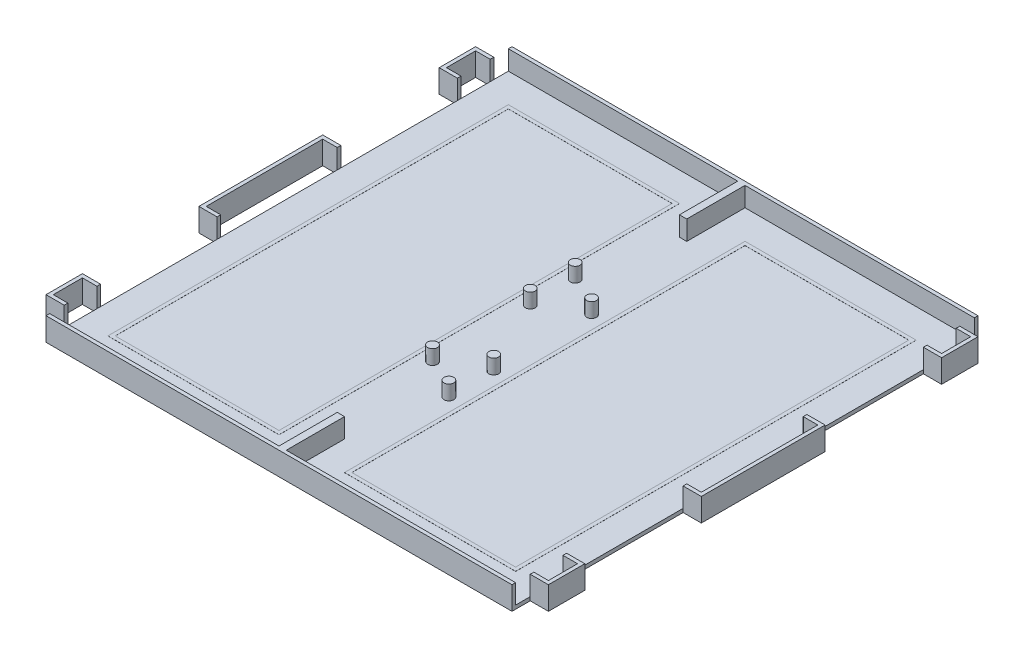
from build123d import *

# Parameters (mm, degrees)
SKETCH1_W                  = 2438.4
SKETCH1_H                  = 2438.4
BOSS_EXTRUDE1_DEPTH        = 19.05
BOSS_EXTRUDE2_DEPTH        = 101.6
BOSS_EXTRUDE3_DEPTH        = 101.6
BOSS_EXTRUDE3_DEPTH_BACK   = 19.05
BOSS_EXTRUDE3_2_DEPTH      = 101.6
BOSS_EXTRUDE3_2_DEPTH_BACK = 19.05
BOSS_EXTRUDE3_3_DEPTH      = 101.6
BOSS_EXTRUDE3_3_DEPTH_BACK = 19.05
BOSS_EXTRUDE3_4_DEPTH      = 101.6
BOSS_EXTRUDE3_4_DEPTH_BACK = 19.05
BOSS_EXTRUDE4_DEPTH        = 101.6
BOSS_EXTRUDE4_DEPTH_BACK   = 19.05
SKETCH6_R                  = 25.4
BOSS_EXTRUDE5_DEPTH        = 76.2
CIRPATTERN1_COUNT          = 2
SKETCH7_W                  = 895.35
SKETCH7_H                  = 2095.5
SKETCH7_W_2                = 857.25
SKETCH7_H_2                = 2057.4
BOSS_EXTRUDE6_DEPTH        = 0.5


with BuildPart() as part:
    # Sketch1 → Boss-Extrude1 (new body)
    with BuildSketch(Plane(origin=(0, 0, 0), x_dir=(1, 0, 0), z_dir=(0, 1, 0))):
        with Locations((1099.154268687, 1137.491799293)):
            Rectangle(SKETCH1_W, SKETCH1_H)
    extrude(amount=BOSS_EXTRUDE1_DEPTH)

    # Sketch2 → Boss-Extrude2 (add)
    with BuildSketch(Plane(origin=(0, 19.05, 0), x_dir=(1, 0, 0), z_dir=(0, 1, 0))):
        Polygon((-120.045731313, -62.658200707), (1080.104268687, -62.658200707), (1080.104268687, 242.141799293), (1118.204268687, 242.141799293), (1118.204268687, -62.658200707), (2318.354268687, -62.658200707), (2318.354268687, -81.708200707), (-120.045731313, -81.708200707), align=None)
        Polygon((-120.045731313, 2356.691799293), (-120.045731313, 2337.641799293), (1080.104268687, 2337.641799293), (1080.104268687, 2032.841799293), (1118.204268687, 2032.841799293), (1118.204268687, 2337.641799293), (2318.354268687, 2337.641799293), (2318.354268687, 2356.691799293), align=None)
    extrude(amount=BOSS_EXTRUDE2_DEPTH)

    # Sketch5 → Boss-Extrude4 (add, two sides: drawn at the far end of the back side and taken through both)
    with BuildSketch(Plane(origin=(0, 19.05, 0), x_dir=(1, 0, 0), z_dir=(0, 1, 0)).offset(-BOSS_EXTRUDE4_DEPTH_BACK)):
        Polygon((-120.045731313, 1461.341799293), (-215.295731313, 1461.341799293), (-215.295731313, 813.641799293), (-120.045731313, 813.641799293), (-120.045731313, 832.691799293), (-196.245731313, 832.691799293), (-196.245731313, 1442.291799293), (-120.045731313, 1442.291799293), align=None)
        Polygon((2318.354268687, 1442.291799293), (2318.354268687, 1461.341799293), (2413.604268687, 1461.341799293), (2413.604268687, 813.641799293), (2318.354268687, 813.641799293), (2318.354268687, 832.691799293), (2394.554268687, 832.691799293), (2394.554268687, 1442.291799293), align=None)
    extrude(amount=BOSS_EXTRUDE4_DEPTH + BOSS_EXTRUDE4_DEPTH_BACK)

    # Sketch6 → Boss-Extrude5 (add)
    with BuildSketch(Plane(origin=(0, 19.05, 0), x_dir=(1, 0, 0), z_dir=(0, 1, 0))):
        with Locations((997.554268687, 823.166799293)):
            Circle(SKETCH6_R)
        with Locations((1200.754268687, 940.484373993)):
            Circle(SKETCH6_R)
        with Locations((1200.754268687, 705.849224594)):
            Circle(SKETCH6_R)
    boss_extrude5 = extrude(amount=BOSS_EXTRUDE5_DEPTH)

    # CirPattern1: Boss-Extrude5 ×2 about axis
    cirpattern1_axis = Axis((1099.118908009, 19.05, -1137.81999058), (0, 1, 0))
    for i in range(1, CIRPATTERN1_COUNT):
        add(boss_extrude5.rotate(cirpattern1_axis, i * 360 / CIRPATTERN1_COUNT))

    # Sketch7 → Boss-Extrude6 (add)
    # profile 1 of 2: a face of its own
    with BuildSketch(Plane(origin=(0, 19.05, 0), x_dir=(1, 0, 0), z_dir=(0, 1, 0))):
        with Locations((480.029268687, 1137.491799293)):
            Rectangle(SKETCH7_W, SKETCH7_H)
        with Locations((480.029268687, 1137.491799293)):
            Rectangle(SKETCH7_W_2, SKETCH7_H_2, mode=Mode.SUBTRACT)
    # profile 2 of 2: a face of its own
    with BuildSketch(Plane(origin=(0, 19.05, 0), x_dir=(1, 0, 0), z_dir=(0, 1, 0))):
        with Locations((1718.279268687, 1137.491799293)):
            Rectangle(SKETCH7_W, SKETCH7_H)
        with Locations((1718.279268687, 1137.491799293)):
            Rectangle(SKETCH7_W_2, SKETCH7_H_2, mode=Mode.SUBTRACT)
    extrude(amount=BOSS_EXTRUDE6_DEPTH)


with BuildPart() as body_2:
    # Sketch3 → Boss-Extrude3 (new, two sides: drawn at the far end of the back side and taken through both)
    with BuildSketch(Plane(origin=(0, 19.05, 0), x_dir=(1, 0, 0), z_dir=(0, 1, 0)).offset(-BOSS_EXTRUDE3_DEPTH_BACK)):
        Polygon((-120.045731313, 32.591799293), (-196.245731313, 32.591799293), (-196.245731313, 184.991799293), (-120.045731313, 184.991799293), (-120.045731313, 204.041799293), (-215.295731313, 204.041799293), (-215.295731313, 13.541799293), (-120.045731313, 13.541799293), align=None)
    extrude(amount=BOSS_EXTRUDE3_DEPTH + BOSS_EXTRUDE3_DEPTH_BACK)


with BuildPart() as body_3:
    # Sketch3 → Boss-Extrude3 2 (new, two sides: drawn at the far end of the back side and taken through both)
    with BuildSketch(Plane(origin=(0, 19.05, 0), x_dir=(1, 0, 0), z_dir=(0, 1, 0)).offset(-BOSS_EXTRUDE3_2_DEPTH_BACK)):
        Polygon((-120.045731313, 2261.441799293), (-120.045731313, 2242.391799293), (-196.245731313, 2242.391799293), (-196.245731313, 2089.991799293), (-120.045731313, 2089.991799293), (-120.045731313, 2070.941799293), (-215.295731313, 2070.941799293), (-215.295731313, 2261.441799293), align=None)
    extrude(amount=BOSS_EXTRUDE3_2_DEPTH + BOSS_EXTRUDE3_2_DEPTH_BACK)


with BuildPart() as body_4:
    # Sketch3 → Boss-Extrude3 3 (new, two sides: drawn at the far end of the back side and taken through both)
    with BuildSketch(Plane(origin=(0, 19.05, 0), x_dir=(1, 0, 0), z_dir=(0, 1, 0)).offset(-BOSS_EXTRUDE3_3_DEPTH_BACK)):
        Polygon((2318.354268687, 2242.391799293), (2394.554268687, 2242.391799293), (2394.554268687, 2089.991799293), (2318.354268687, 2089.991799293), (2318.354268687, 2070.941799293), (2413.604268687, 2070.941799293), (2413.604268687, 2261.441799293), (2318.354268687, 2261.441799293), align=None)
    extrude(amount=BOSS_EXTRUDE3_3_DEPTH + BOSS_EXTRUDE3_3_DEPTH_BACK)


with BuildPart() as body_5:
    # Sketch3 → Boss-Extrude3 4 (new, two sides: drawn at the far end of the back side and taken through both)
    with BuildSketch(Plane(origin=(0, 19.05, 0), x_dir=(1, 0, 0), z_dir=(0, 1, 0)).offset(-BOSS_EXTRUDE3_4_DEPTH_BACK)):
        Polygon((2318.354268687, 13.541799293), (2318.354268687, 32.591799293), (2394.554268687, 32.591799293), (2394.554268687, 184.991799293), (2318.354268687, 184.991799293), (2318.354268687, 204.041799293), (2413.604268687, 204.041799293), (2413.604268687, 13.541799293), align=None)
    extrude(amount=BOSS_EXTRUDE3_4_DEPTH + BOSS_EXTRUDE3_4_DEPTH_BACK)


solid = Compound([part.part, body_2.part, body_3.part, body_4.part, body_5.part])
